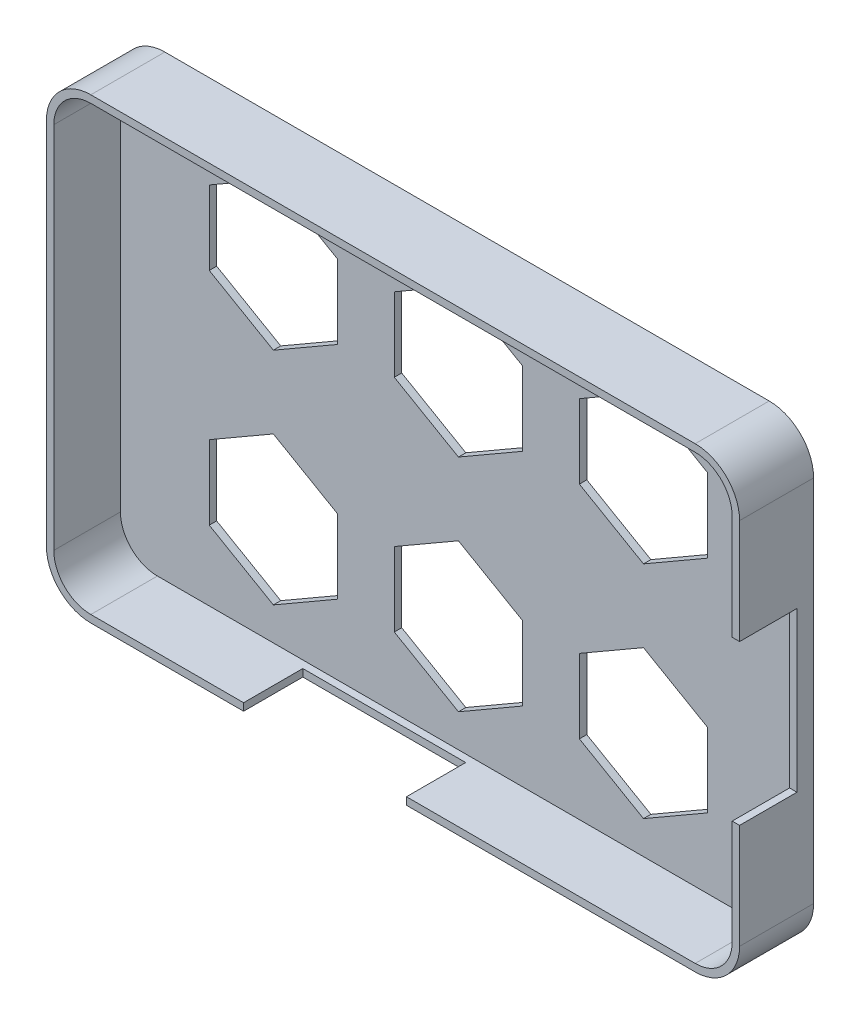
from build123d import *

# Parameters (mm, degrees)
SKIZZE1_W                       = 61.8
SKIZZE1_H                       = 93.64
AUFSATZ_LINEAR_AUSTRAGEN1_DEPTH = 10
VERRUNDUNG1_R                   = 6
WANDUNG1_T                      = -1
SKIZZE2_W                       = 21.5
SKIZZE2_H                       = 15.5
SCHNITT_LINEAR_AUSTRAGEN1_DEPTH = 6
SKIZZE3_W                       = 22
SKIZZE3_H                       = 8
SCHNITT_LINEAR_AUSTRAGEN2_DEPTH = 6
SCHNITT_LINEAR_AUSTRAGEN4_DEPTH = 6
LINEARES_MUSTER1_COUNT          = 3
LINEARES_MUSTER1_PITCH          = 25


with BuildPart() as part:
    # Skizze1 → Aufsatz-Linear austragen1 (new body)
    with BuildSketch(Plane(origin=(0, 0, 0), x_dir=(0, 1, 0), z_dir=(0, 0, 1))):
        Rectangle(SKIZZE1_W, SKIZZE1_H)
    extrude(amount=AUFSATZ_LINEAR_AUSTRAGEN1_DEPTH)

    # Verrundung1
    verrundung1_edges = [part.edges().sort_by_distance(p)[0] for p in [
        (46.82, 30.9, 5),
        (46.82, -30.9, 5),
        (-46.82, -30.9, 5),
        (-46.82, 30.9, 5),
    ]]
    fillet(verrundung1_edges, radius=VERRUNDUNG1_R)

    # Wandung1
    wandung1_openings = [part.faces().sort_by_distance(p)[0] for p in [
        (0, 0, 10),
    ]]
    offset(amount=WANDUNG1_T, openings=wandung1_openings, kind=Kind.INTERSECTION)

    # Skizze2 → Schnitt-Linear austragen1 (cut)
    with BuildSketch(Plane.YZ.offset(46.82)):
        with Locations((0, 10)):
            Rectangle(SKIZZE2_W, SKIZZE2_H)
    extrude(amount=-SCHNITT_LINEAR_AUSTRAGEN1_DEPTH, mode=Mode.SUBTRACT)

    # Skizze3 → Schnitt-Linear austragen2 (cut)
    with BuildSketch(Plane.XZ.offset(30.9)):
        with Locations((-9.18, 6)):
            Rectangle(SKIZZE3_W, SKIZZE3_H)
    extrude(amount=-SCHNITT_LINEAR_AUSTRAGEN2_DEPTH, mode=Mode.SUBTRACT)

    # Skizze4 → Schnitt-Linear austragen4 (cut)
    with BuildSketch(Plane(origin=(0, 0, 0), x_dir=(1, 0, 0), z_dir=(0, 0, -1))):
        Polygon((-25.159745962, 25.45), (-33.82, 20.45), (-33.82, 10.45), (-25.159745962, 5.45), (-16.499491924, 10.45), (-16.499491924, 20.45), align=None)
        Polygon((-25.159745962, -4.35), (-33.82, -9.35), (-33.82, -19.35), (-25.159745962, -24.35), (-16.499491924, -19.35), (-16.499491924, -9.35), align=None)
    schnitt_linear_austragen4 = extrude(amount=-SCHNITT_LINEAR_AUSTRAGEN4_DEPTH, mode=Mode.SUBTRACT)

    # Lineares Muster1: Schnitt-Linear austragen4 ×3
    with Locations(*[(i * LINEARES_MUSTER1_PITCH, 0, 0) for i in range(1, LINEARES_MUSTER1_COUNT)]):
        add(schnitt_linear_austragen4, mode=Mode.SUBTRACT)


solid = part.part
